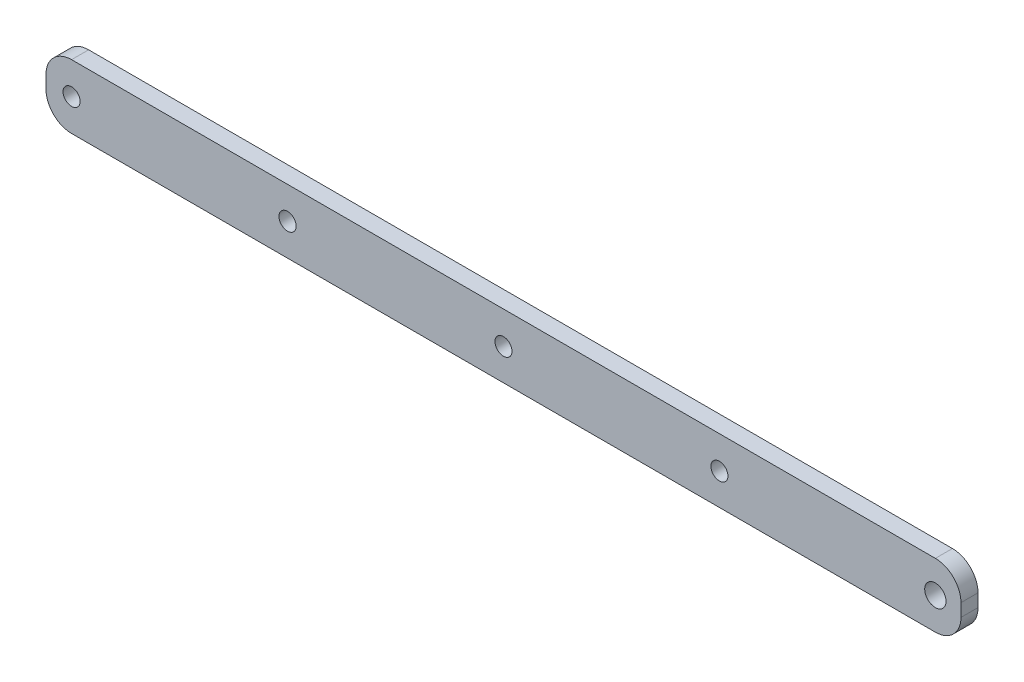
from build123d import *

# Parameters (mm, degrees)
SKETCH1_R           = 3.175
SKETCH1_R_2         = 2.54
SKETCH1_R_3         = 2.558645837
BOSS_EXTRUDE1_DEPTH = 5.08


with BuildPart() as part:
    # Sketch1 → Boss-Extrude1 (new body)
    with BuildSketch(Plane.XY):
        with BuildLine():
            Line((7.62, 0), (264.922, 0))
            ThreePointArc((264.922, 0), (270.310153673, 2.231846327), (272.542, 7.62))
            Line((272.542, 7.62), (272.542, 11.43))
            ThreePointArc((272.542, 11.43), (270.310153673, 16.818153673), (264.922, 19.05))
            Line((264.922, 19.05), (7.62, 19.05))
            ThreePointArc((7.62, 19.05), (2.231846327, 16.818153673), (0, 11.43))
            Line((0, 11.43), (0, 7.62))
            ThreePointArc((0, 7.62), (2.231846327, 2.231846327), (7.62, 0))
        make_face()
        with Locations((264.922, 9.525)):
            Circle(SKETCH1_R, mode=Mode.SUBTRACT)
        with Locations((7.62, 9.525)):
            Circle(SKETCH1_R_2, mode=Mode.SUBTRACT)
        with Locations((71.9455, 9.525)):
            Circle(SKETCH1_R_3, mode=Mode.SUBTRACT)
        with Locations((136.271, 9.398)):
            Circle(SKETCH1_R_2, mode=Mode.SUBTRACT)
        with Locations((200.5965, 9.398)):
            Circle(SKETCH1_R_2, mode=Mode.SUBTRACT)
    extrude(amount=BOSS_EXTRUDE1_DEPTH)


solid = part.part
